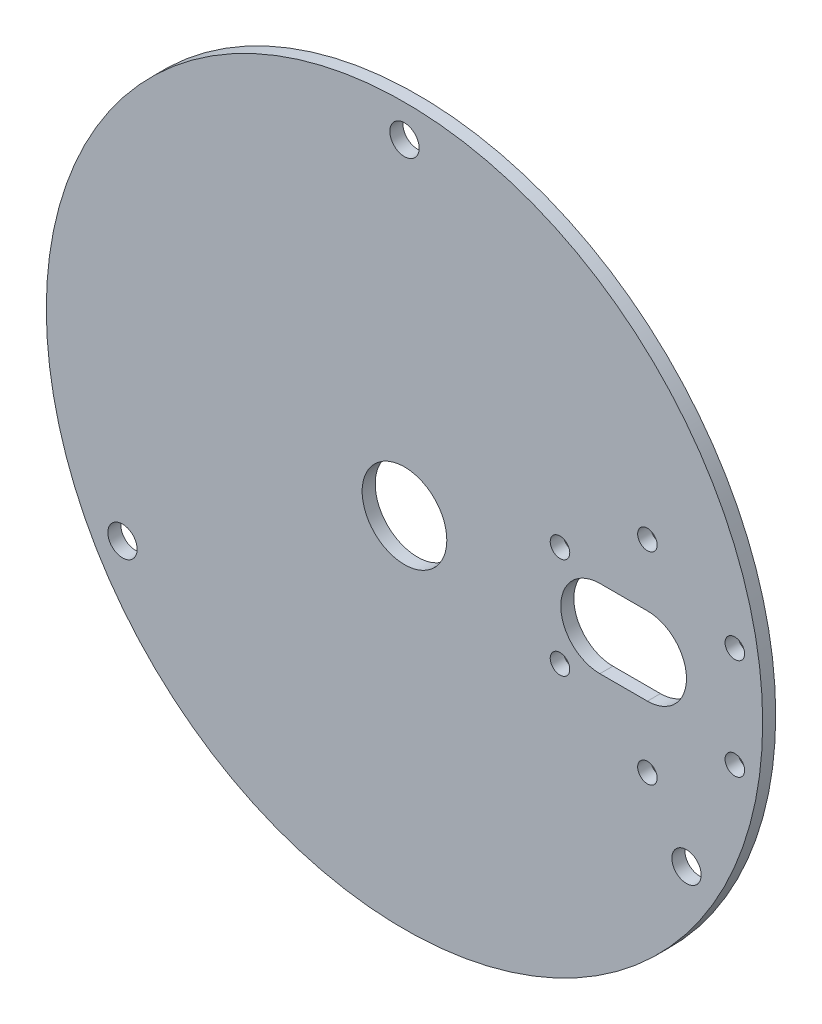
from build123d import *

# Parameters (mm, degrees)
SKETCH_1_R          = 55
SKETCH_1_R_2        = 1.5
SKETCH_1_R_3        = 6.5
EXTRUDE_1_DEPTH     = 2
SKETCH_3_R          = 2.25
CUT_EXTRUDE_1_DEPTH = 78.807454656


with BuildPart() as part:
    # 草图1 → 凸台-拉伸1 (new body)
    with BuildSketch(Plane.XY):
        Circle(SKETCH_1_R)
        with Locations((37.3, 15.5)):
            Circle(SKETCH_1_R_2, mode=Mode.SUBTRACT)
        with Locations((50.723393759, 7.75)):
            Circle(SKETCH_1_R_2, mode=Mode.SUBTRACT)
        with Locations((50.723393759, -7.75)):
            Circle(SKETCH_1_R_2, mode=Mode.SUBTRACT)
        with Locations((37.3, -15.5)):
            Circle(SKETCH_1_R_2, mode=Mode.SUBTRACT)
        with Locations((23.876606241, -7.75)):
            Circle(SKETCH_1_R_2, mode=Mode.SUBTRACT)
        with Locations((23.876606241, 7.75)):
            Circle(SKETCH_1_R_2, mode=Mode.SUBTRACT)
        Circle(SKETCH_1_R_3, mode=Mode.SUBTRACT)
        with BuildLine():
            Line((37.3, -6), (30, -6))
            ThreePointArc((30, -6), (24, 0), (30, 6))
            Line((30, 6), (37.3, 6))
            ThreePointArc((37.3, 6), (43.3, 0), (37.3, -6))
        make_face(mode=Mode.SUBTRACT)
    extrude(amount=EXTRUDE_1_DEPTH)

    # 草图3 → 切除-拉伸1 (cut, through all)
    with BuildSketch(Plane.XY.offset(2)):
        with Locations((0, 50)):
            Circle(SKETCH_3_R)
        with Locations((43.301270189, -25)):
            Circle(SKETCH_3_R)
        with Locations((-43.301270189, -25)):
            Circle(SKETCH_3_R)
    extrude(amount=-CUT_EXTRUDE_1_DEPTH, mode=Mode.SUBTRACT)


solid = part.part
